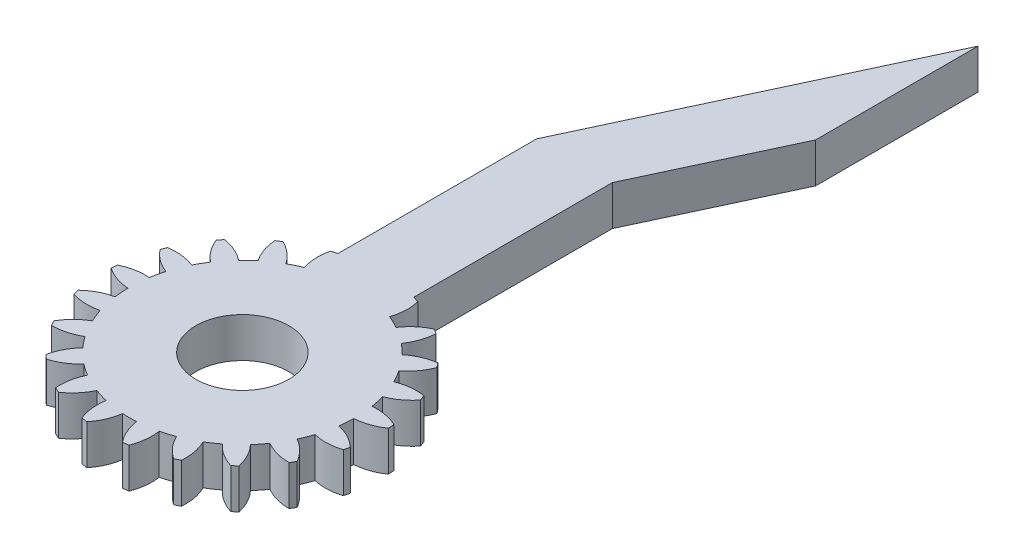
from build123d import *

# Parameters (mm, degrees)
SKETCH1_R           = 3.5
BOSS_EXTRUDE1_DEPTH = 3
BOSS_EXTRUDE2_DEPTH = 3


with BuildPart() as part:
    # Sketch1 → Boss-Extrude1 (new body)
    with BuildSketch(Plane(origin=(0, 0, 0), x_dir=(1, 0, 0), z_dir=(0, 1, 0))):
        with BuildLine():
            Line((0.22, 10.45), (-0.22, 10.45))
            ThreePointArc((-0.22, 10.45), (-0.619608599, 9.494397866), (-0.75, 8.466847111))
            ThreePointArc((-0.75, 8.466847111), (-1.266859262, 8.405062023), (-1.778967393, 8.311755231))
            ThreePointArc((-1.778967393, 8.311755231), (-2.206441771, 9.255221249), (-2.869965555, 10.050581959))
            Line((-2.869965555, 10.050581959), (-3.29041759, 9.920889682))
            ThreePointArc((-3.29041759, 9.920889682), (-3.390604026, 8.889955567), (-3.212326601, 7.869622469))
            ThreePointArc((-3.212326601, 7.869622469), (-3.688011782, 7.658235377), (-4.149865725, 7.418127423))
            ThreePointArc((-4.149865725, 7.418127423), (-4.836440108, 8.193677608), (-5.704922076, 8.758125604))
            Line((-5.704922076, 8.758125604), (-6.068467137, 8.510264779))
            ThreePointArc((-6.068467137, 8.510264779), (-5.860329406, 7.495601704), (-5.389223887, 6.573147336))
            ThreePointArc((-5.389223887, 6.573147336), (-5.781468271, 6.230940911), (-6.152030277, 5.865366439))
            ThreePointArc((-6.152030277, 5.865366439), (-7.036699516, 6.404089754), (-8.032971235, 6.687471356))
            Line((-8.032971235, 6.687471356), (-8.307306748, 6.343465503))
            ThreePointArc((-8.307306748, 6.343465503), (-7.809338801, 5.435230735), (-7.08726498, 4.692619216))
            ThreePointArc((-7.08726498, 4.692619216), (-7.361215932, 4.25), (-7.607559941, 3.791441908))
            ThreePointArc((-7.607559941, 3.791441908), (-8.611717292, 4.045470421), (-9.647255648, 4.022605929))
            Line((-9.647255648, 4.022605929), (-9.808005699, 3.61302148))
            ThreePointArc((-9.808005699, 3.61302148), (-9.064454173, 2.891915663), (-8.155571478, 2.395131285))
            ThreePointArc((-8.155571478, 2.395131285), (-8.286887254, 1.891427939), (-8.387124519, 1.380631125))
            ThreePointArc((-8.387124519, 1.380631125), (-9.421546195, 1.327393289), (-10.40433906, 1.000314313))
            Line((-10.40433906, 1.000314313), (-10.437220301, 0.561544643))
            ThreePointArc((-10.437220301, 0.561544643), (-9.514153012, 0.091641193), (-8.499219659, -0.115174571))
            ThreePointArc((-8.499219659, -0.115174571), (-8.476232276, -0.635205795), (-8.421456277, -1.152854793))
            ThreePointArc((-8.421456277, -1.152854793), (-9.394229373, -1.508628563), (-10.236951288, -2.110859619))
            Line((-10.236951288, -2.110859619), (-10.139042077, -2.539827901))
            ThreePointArc((-10.139042077, -2.539827901), (-9.118477605, -2.716775998), (-8.087674876, -2.615246661))
            ThreePointArc((-8.087674876, -2.615246661), (-7.912426863, -3.105398707), (-7.707504688, -3.583904503))
            ThreePointArc((-7.707504688, -3.583904503), (-8.532194045, -4.210602146), (-9.15996547, -5.034474411))
            Line((-9.15996547, -5.034474411), (-8.93996547, -5.415525589))
            ThreePointArc((-8.93996547, -5.415525589), (-7.912585446, -5.28379572), (-6.957504688, -4.882942608))
            ThreePointArc((-6.957504688, -4.882942608), (-6.645567601, -5.299663316), (-6.308707484, -5.69650857))
            ThreePointArc((-6.308707484, -5.69650857), (-6.912035833, -6.53844525), (-7.269076522, -7.510754058))
            Line((-7.269076522, -7.510754058), (-6.946533698, -7.810030063))
            ThreePointArc((-6.946533698, -7.810030063), (-6.003625347, -7.381327005), (-5.209129676, -6.716767676))
            ThreePointArc((-5.209129676, -6.716767676), (-4.788220494, -7.023029582), (-4.349353934, -7.302952852))
            ThreePointArc((-4.349353934, -7.302952852), (-4.677712905, -8.285318801), (-4.732298225, -9.319670247))
            Line((-4.732298225, -9.319670247), (-4.335871923, -9.510579092))
            ThreePointArc((-4.335871923, -9.510579092), (-3.561216789, -8.822994992), (-2.997900632, -7.953778461))
            ThreePointArc((-2.997900632, -7.953778461), (-2.505418982, -8.122368849), (-2.0035412, -8.260497725))
            ThreePointArc((-2.0035412, -8.260497725), (-2.027754657, -9.296005416), (-1.775034463, -10.300492835))
            Line((-1.775034463, -10.300492835), (-1.3399489, -10.366071433))
            ThreePointArc((-1.3399489, -10.366071433), (-0.802378491, -9.480701156), (-0.520294961, -8.484061124))
            ThreePointArc((-0.520294961, -8.484061124), (0, -8.5), (0.520294961, -8.484061124))
            ThreePointArc((0.520294961, -8.484061124), (0.802378491, -9.480701156), (1.3399489, -10.366071433))
            Line((1.3399489, -10.366071433), (1.775034463, -10.300492835))
            ThreePointArc((1.775034463, -10.300492835), (2.027754657, -9.296005416), (2.0035412, -8.260497725))
            ThreePointArc((2.0035412, -8.260497725), (2.505418982, -8.122368849), (2.997900632, -7.953778461))
            ThreePointArc((2.997900632, -7.953778461), (3.561216789, -8.822994992), (4.335871923, -9.510579092))
            Line((4.335871923, -9.510579092), (4.732298225, -9.319670247))
            ThreePointArc((4.732298225, -9.319670247), (4.677712905, -8.285318801), (4.349353934, -7.302952852))
            ThreePointArc((4.349353934, -7.302952852), (4.788220494, -7.023029582), (5.209129676, -6.716767676))
            ThreePointArc((5.209129676, -6.716767676), (6.003625347, -7.381327005), (6.946533698, -7.810030063))
            Line((6.946533698, -7.810030063), (7.269076522, -7.510754058))
            ThreePointArc((7.269076522, -7.510754058), (6.912035833, -6.53844525), (6.308707484, -5.69650857))
            ThreePointArc((6.308707484, -5.69650857), (6.645567601, -5.299663316), (6.957504688, -4.882942608))
            ThreePointArc((6.957504688, -4.882942608), (7.912585446, -5.28379572), (8.93996547, -5.415525589))
            Line((8.93996547, -5.415525589), (9.15996547, -5.034474411))
            ThreePointArc((9.15996547, -5.034474411), (8.532194045, -4.210602146), (7.707504688, -3.583904503))
            ThreePointArc((7.707504688, -3.583904503), (7.912426863, -3.105398707), (8.087674876, -2.615246661))
            ThreePointArc((8.087674876, -2.615246661), (9.118477605, -2.716775998), (10.139042077, -2.539827901))
            Line((10.139042077, -2.539827901), (10.236951288, -2.110859619))
            ThreePointArc((10.236951288, -2.110859619), (9.394229373, -1.508628563), (8.421456277, -1.152854793))
            ThreePointArc((8.421456277, -1.152854793), (8.476232276, -0.635205795), (8.499219659, -0.115174571))
            ThreePointArc((8.499219659, -0.115174571), (9.514153012, 0.091641193), (10.437220301, 0.561544643))
            Line((10.437220301, 0.561544643), (10.40433906, 1.000314313))
            ThreePointArc((10.40433906, 1.000314313), (9.421546195, 1.327393289), (8.387124519, 1.380631125))
            ThreePointArc((8.387124519, 1.380631125), (8.286887254, 1.891427939), (8.155571478, 2.395131285))
            ThreePointArc((8.155571478, 2.395131285), (9.064454173, 2.891915663), (9.808005699, 3.61302148))
            Line((9.808005699, 3.61302148), (9.647255648, 4.022605929))
            ThreePointArc((9.647255648, 4.022605929), (8.611717292, 4.045470421), (7.607559941, 3.791441908))
            ThreePointArc((7.607559941, 3.791441908), (7.361215932, 4.25), (7.08726498, 4.692619216))
            ThreePointArc((7.08726498, 4.692619216), (7.809338801, 5.435230735), (8.307306748, 6.343465503))
            Line((8.307306748, 6.343465503), (8.032971235, 6.687471356))
            ThreePointArc((8.032971235, 6.687471356), (7.036699516, 6.404089754), (6.152030277, 5.865366439))
            ThreePointArc((6.152030277, 5.865366439), (5.781468271, 6.230940911), (5.389223887, 6.573147336))
            ThreePointArc((5.389223887, 6.573147336), (5.860329406, 7.495601704), (6.068467137, 8.510264779))
            Line((6.068467137, 8.510264779), (5.704922076, 8.758125604))
            ThreePointArc((5.704922076, 8.758125604), (4.836440108, 8.193677608), (4.149865725, 7.418127423))
            ThreePointArc((4.149865725, 7.418127423), (3.688011782, 7.658235377), (3.212326601, 7.869622469))
            ThreePointArc((3.212326601, 7.869622469), (3.390604026, 8.889955567), (3.29041759, 9.920889682))
            Line((3.29041759, 9.920889682), (2.869965555, 10.050581959))
            ThreePointArc((2.869965555, 10.050581959), (2.206441771, 9.255221249), (1.778967393, 8.311755231))
            ThreePointArc((1.778967393, 8.311755231), (1.266859262, 8.405062023), (0.75, 8.466847111))
            ThreePointArc((0.75, 8.466847111), (0.619608599, 9.494397866), (0.22, 10.45))
        make_face()
        with Locations(Location((0, 0, 0), (0, 0, 270))):
            Circle(SKETCH1_R, mode=Mode.SUBTRACT)
    extrude(amount=BOSS_EXTRUDE1_DEPTH)

    # Sketch4 → Boss-Extrude2 (add)
    with BuildSketch(Plane(origin=(0, 3, 0), x_dir=(1, 0, 0), z_dir=(0, 1, 0))):
        Polygon((-2.85, 4.257844413), (-2.85, 25), (7.715456544, 47.657694676), (7.715456544, 35.434005229), (2.85, 25), (2.85, 4.257844413), align=None)
    extrude(amount=-BOSS_EXTRUDE2_DEPTH)


solid = part.part
